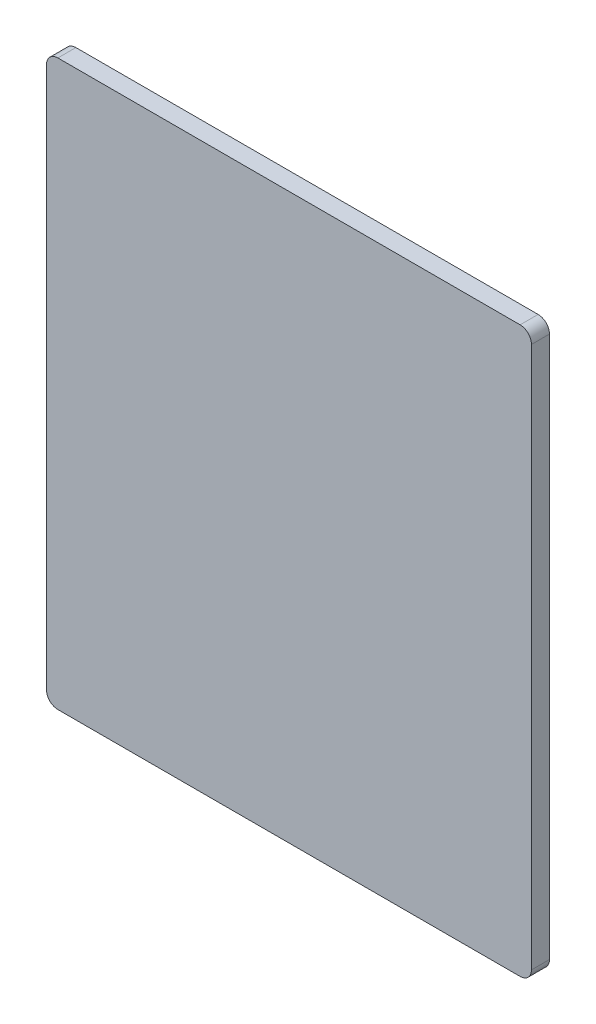
from build123d import *

# Parameters (mm, degrees)
BOSS_EXTRUDE1_DEPTH = 3.175


with BuildPart() as part:
    # Sketch1 → Boss-Extrude1 (new body)
    with BuildSketch(Plane.XY):
        with BuildLine():
            Line((-40.75, 0), (40.75, 0))
            ThreePointArc((40.75, 0), (42.164213562, -0.585786438), (42.75, -2))
            Line((42.75, -2), (42.75, -97.5))
            ThreePointArc((42.75, -97.5), (42.164213562, -98.914213562), (40.75, -99.5))
            Line((40.75, -99.5), (-40.75, -99.5))
            ThreePointArc((-40.75, -99.5), (-42.164213562, -98.914213562), (-42.75, -97.5))
            Line((-42.75, -97.5), (-42.75, -2))
            ThreePointArc((-42.75, -2), (-42.164213562, -0.585786438), (-40.75, 0))
        make_face()
    extrude(amount=BOSS_EXTRUDE1_DEPTH)


solid = part.part
